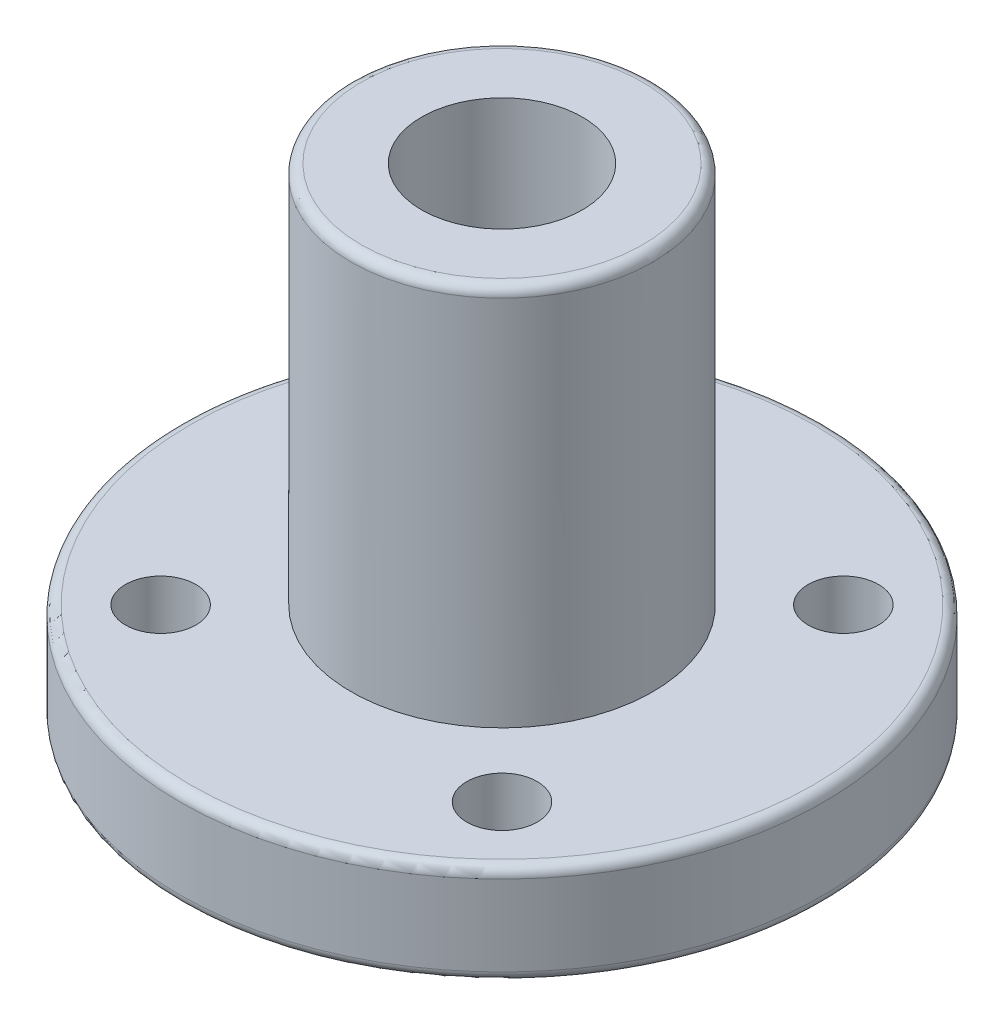
from build123d import *

# Parameters (mm, degrees)
SKETCH1_R           = 7.5
SKETCH1_R_2         = 4
BOSS_EXTRUDE1_DEPTH = 24
SKETCH2_R           = 16
SKETCH2_R_2         = 1.75
SKETCH2_R_3         = 7.5
BOSS_EXTRUDE2_DEPTH = 5
FILLET2_R           = 0.5


with BuildPart() as part:
    # Sketch1 → Boss-Extrude1 (new body)
    with BuildSketch(Plane(origin=(0, 0, 0), x_dir=(1, 0, 0), z_dir=(0, 1, 0))):
        with Locations(Location((0, 0, 0), (0, 0, 270))):
            Circle(SKETCH1_R)
        with Locations(Location((0, 0, 0), (0, 0, 270))):
            Circle(SKETCH1_R_2, mode=Mode.SUBTRACT)
    extrude(amount=BOSS_EXTRUDE1_DEPTH)

    # Sketch2 → Boss-Extrude2 (add)
    with BuildSketch(Plane.XZ):
        with Locations(Location((0, 0, 0), (0, 0, 270))):
            Circle(SKETCH2_R)
        with Locations(Location((8.485281374, 8.485281374, 0), (0, 0, 270))):
            Circle(SKETCH2_R_2, mode=Mode.SUBTRACT)
        with Locations(Location((0, 0, 0), (0, 0, 270))):
            Circle(SKETCH2_R_3, mode=Mode.SUBTRACT)
        with Locations(Location((-8.485281374, 8.485281374, 0), (0, 0, 90))):
            Circle(SKETCH2_R_2, mode=Mode.SUBTRACT)
        with Locations(Location((-8.485281374, -8.485281374, 0), (0, 0, 270))):
            Circle(SKETCH2_R_2, mode=Mode.SUBTRACT)
        with Locations(Location((8.485281374, -8.485281374, 0), (0, 0, 90))):
            Circle(SKETCH2_R_2, mode=Mode.SUBTRACT)
    extrude(amount=-BOSS_EXTRUDE2_DEPTH)

    # Fillet2
    fillet2_edges = [part.edges().sort_by_distance(p)[0] for p in [
        (0, 5, 16),
        (0, 0, 16),
        (0, 24, -7.5),
    ]]
    fillet(fillet2_edges, radius=FILLET2_R)


solid = part.part
